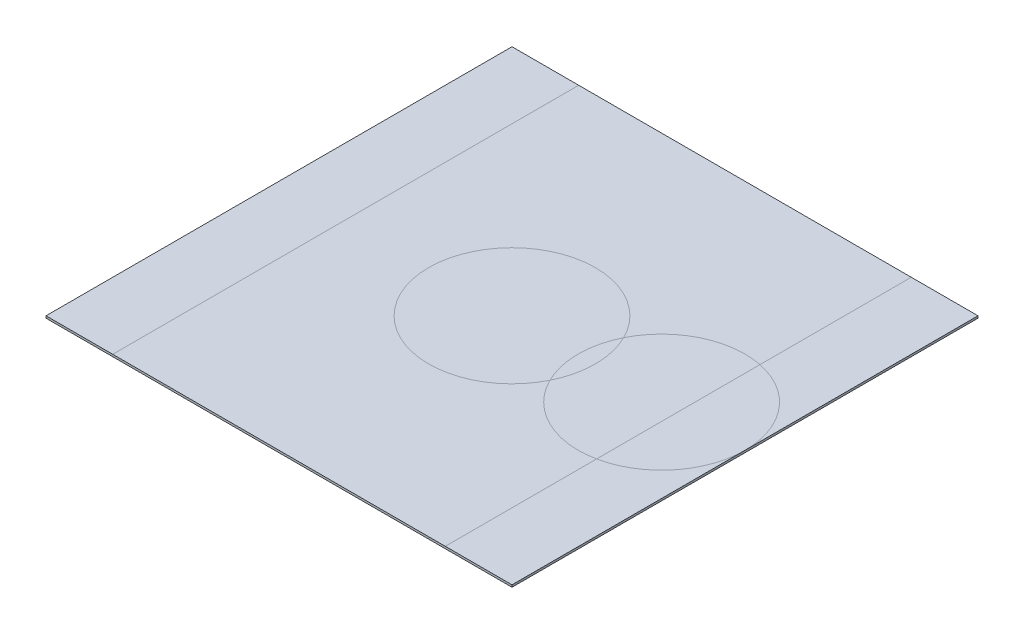
from build123d import *

# Parameters (mm, degrees)
SKETCH1_W           = 139.7
SKETCH1_H           = 139.7
BOSS_EXTRUDE1_DEPTH = 0.3175


with BuildPart() as part:
    # Sketch1 → Boss-Extrude1 (new, symmetric)
    with BuildSketch(Plane(origin=(0, 0, 0), x_dir=(1, 0, 0), z_dir=(0, 1, 0))):
        Rectangle(SKETCH1_W, SKETCH1_H)
    extrude(amount=BOSS_EXTRUDE1_DEPTH, both=True)


solid = part.part
